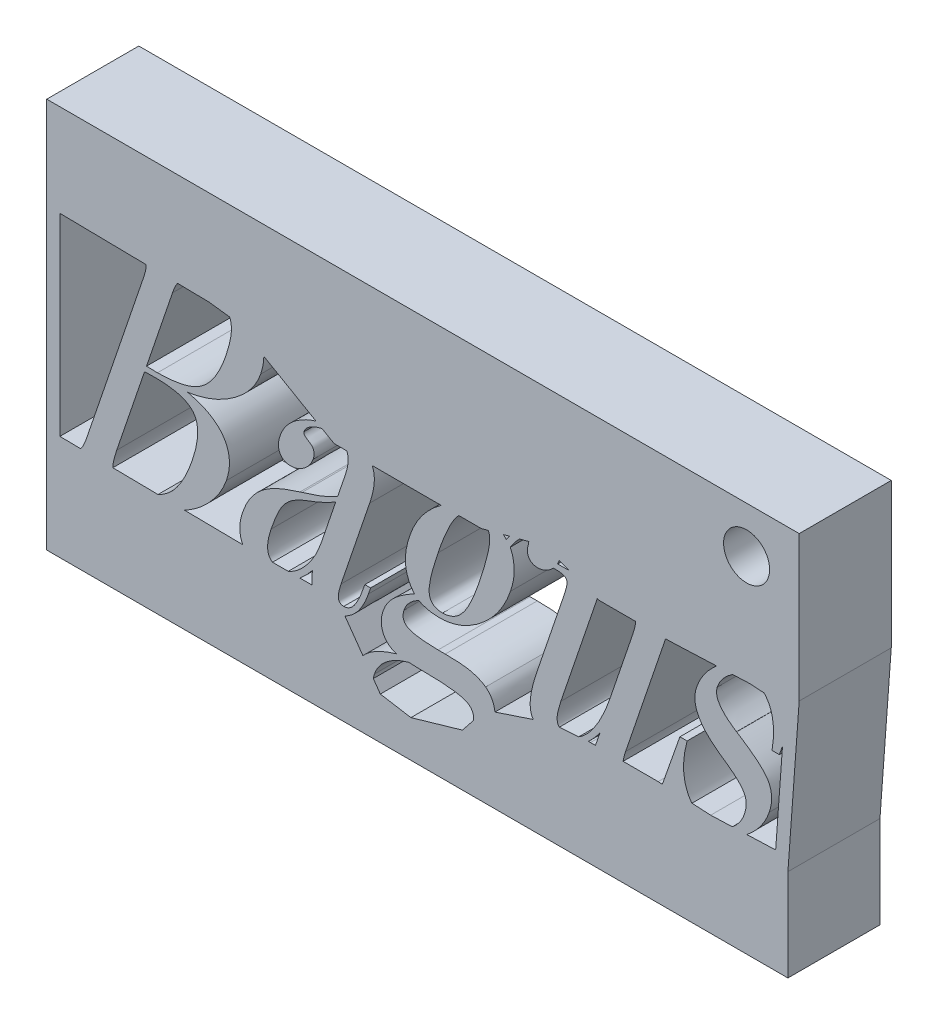
from build123d import *

# Parameters (mm, degrees)
BOSS_EXTRUDE1_DEPTH = 7
BOSS_EXTRUDE3_DEPTH = 7
BOSS_EXTRUDE4_DEPTH = 7
SKETCH4_R           = 1.75
CUT_EXTRUDE1_DEPTH  = 62.943507145


with BuildPart() as part:
    # Sketch1 → Boss-Extrude1 (new body)
    # profile 1 of 5: a face of its own
    with BuildSketch(Plane.XY):
        with BuildLine():
            Line((0.217105263, 0), (0.366365132, 0.434210526))
            Line((0.366365132, 0.434210526), (1.102487664, 0.434210526))
            add(Edge.make_bspline(
                [(1.102487664, 0.434210526), (1.234941951, 0.436867578), (1.483057386, 0.44184481), (1.826532671, 0.492741642), (2.111874884, 0.584655965), (2.352565812, 0.712506725), (2.546627765, 0.909076169), (2.723285687, 1.161183153), (2.884267508, 1.48339522), (2.972030419, 1.725609965), (3.019120066, 1.855571546)],
                knots=[0, 0, 0, 0, 1.208670935, 2.26410124, 3.155129681, 3.936062639, 4.724394753, 5.649444076, 6.738796995, 8, 8, 8, 8], degree=3))
            Line((3.019120066, 1.855571546), (7.384971217, 14.69870477))
            add(Edge.make_bspline(
                [(7.384971217, 14.69870477), (7.423759516, 14.821184991), (7.493759767, 15.042221915), (7.553531903, 15.348860217), (7.557136275, 15.593105356), (7.502714672, 15.789953243), (7.358367624, 15.925122809), (7.150285742, 16.008127942), (6.872979863, 16.060205863), (6.663842277, 16.063789003), (6.547080592, 16.065789474)],
                knots=[0, 0, 0, 0, 1.447238597, 2.611794517, 3.503668476, 4.188541488, 4.837144007, 5.646895606, 6.686259889, 8, 8, 8, 8], degree=3))
            Line((6.547080592, 16.065789474), (6.414782072, 16.065789474))
            Line((6.414782072, 16.065789474), (5.678659539, 16.065789474))
            Line((5.678659539, 16.065789474), (5.824527138, 16.5))
            Line((5.824527138, 16.5), (12.398745888, 16.5))
            add(Edge.make_bspline(
                [(12.398745888, 16.5), (12.600139396, 16.498290198), (12.987714338, 16.494999744), (13.544870697, 16.44516658), (14.055297532, 16.373066953), (14.519531068, 16.270275886), (14.934655872, 16.130320904), (15.304959961, 15.96563611), (15.627932198, 15.768491413), (15.901447534, 15.539236803), (16.131392692, 15.28417944), (16.300380282, 14.9937932), (16.426488912, 14.680085544), (16.495836229, 14.337904198), (16.515286773, 13.968978488), (16.482026895, 13.573862309), (16.400068058, 13.150711955), (16.309677894, 12.866059934), (16.262541118, 12.717619243)],
                knots=[0, 0, 0, 0, 1.438019672, 2.767419842, 3.991889429, 5.118498219, 6.158013592, 7.115880268, 8.007983498, 8.850792557, 9.657697218, 10.447235635, 11.23764111, 12.062930467, 12.928497478, 13.868213022, 14.888313067, 16, 16, 16, 16], degree=3))
            add(Edge.make_bspline(
                [(16.262541118, 12.717619243), (16.218634237, 12.596715491), (16.130671164, 12.354496843), (15.952703511, 12.006698007), (15.747777661, 11.666842799), (15.502742741, 11.341217693), (15.233062048, 11.020777029), (14.924965338, 10.715209538), (14.584983832, 10.420995194), (14.218194262, 10.137023214), (13.826093864, 9.874889842), (13.419957451, 9.633996791), (13.000413262, 9.418111286), (12.56681607, 9.232836565), (12.119238739, 9.07236544), (11.659456287, 8.937421647), (11.186208345, 8.826888953), (10.864690986, 8.777136571), (10.70261102, 8.752055921)],
                knots=[0, 0, 0, 0, 0.861657859, 1.726245857, 2.614315257, 3.519564351, 4.455378282, 5.420343214, 6.425254088, 7.468555063, 8.528336489, 9.585429798, 10.633156394, 11.689379355, 12.744540606, 13.819294024, 14.900685323, 16, 16, 16, 16], degree=3))
            add(Edge.make_bspline(
                [(10.70261102, 8.752055921), (10.860335548, 8.714595528), (11.167340721, 8.641680207), (11.604839812, 8.500627919), (12.0028058, 8.331133222), (12.369643187, 8.152694559), (12.691447345, 7.939208905), (12.980819076, 7.711070505), (13.234170914, 7.460555567), (13.444160503, 7.183428747), (13.618366233, 6.891494078), (13.753575336, 6.583351606), (13.841127668, 6.257332175), (13.888481883, 5.916616259), (13.894308462, 5.56028515), (13.859718941, 5.188326668), (13.781018644, 4.800891349), (13.699296883, 4.542703331), (13.657277961, 4.409950658)],
                knots=[0, 0, 0, 0, 1.27154665, 2.475020249, 3.600264177, 4.663480099, 5.669811574, 6.622971171, 7.551328935, 8.456206246, 9.343165159, 10.213284382, 11.0870137, 11.982757003, 12.905503248, 13.876494216, 14.908155881, 16, 16, 16, 16], degree=3))
            add(Edge.make_bspline(
                [(13.657277961, 4.409950658), (13.589051228, 4.230566629), (13.45023318, 3.86558153), (13.160076787, 3.344087635), (12.807345816, 2.834412801), (12.392618835, 2.346154179), (11.933376365, 1.88355635), (11.42966199, 1.468123355), (10.894561581, 1.094646739), (10.511391764, 0.887480051), (10.319284539, 0.783614309)],
                knots=[0, 0, 0, 0, 0.912300883, 1.85622004, 2.83089555, 3.858144996, 4.90068446, 5.928610154, 6.961481476, 8, 8, 8, 8], degree=3))
            add(Edge.make_bspline(
                [(10.319284539, 0.783614309), (10.178977761, 0.716722531), (9.895225059, 0.581442375), (9.444390053, 0.421235915), (8.973029833, 0.285661676), (8.471491116, 0.174701809), (7.923036024, 0.092530897), (7.310995951, 0.043792449), (6.629039031, 0.002632619), (6.15026232, 0.000905714), (5.899157072, 0)],
                knots=[0, 0, 0, 0, 0.822773354, 1.663954969, 2.530197419, 3.419485951, 4.382510394, 5.464765732, 6.670339192, 8, 8, 8, 8], degree=3))
            Line((5.899157072, 0), (0.217105263, 0))
        make_face()
        with BuildLine():
            add(Edge.make_bspline(
                [(7.585115132, 8.901315789), (7.637130553, 8.899085972), (7.744547501, 8.89448118), (7.923131525, 8.886150784), (8.14822922, 8.883637163), (8.317847702, 8.884091145), (8.416221217, 8.884354441)],
                knots=[0, 0, 0, 0, 0.751447154, 1.55181209, 2.580126133, 4, 4, 4, 4], degree=3))
            add(Edge.make_bspline(
                [(8.416221217, 8.884354441), (8.596065824, 8.887176725), (8.945976945, 8.892667847), (9.453626122, 8.928719056), (9.926998477, 8.993550493), (10.36481324, 9.080285905), (10.769008852, 9.192292165), (11.139289434, 9.329312465), (11.473689863, 9.497145905), (11.779147568, 9.689078119), (12.058315578, 9.919029794), (12.322269579, 10.184304091), (12.575656779, 10.488743458), (12.81191804, 10.836334651), (13.035142641, 11.225254045), (13.248814923, 11.65304914), (13.449370302, 12.122010726), (13.56640278, 12.452320203), (13.626747533, 12.622635691)],
                knots=[0, 0, 0, 0, 1.228843792, 2.390875742, 3.474794627, 4.491507911, 5.438172019, 6.337926543, 7.184458294, 7.990349871, 8.797610598, 9.649869939, 10.544134351, 11.499929116, 12.517669339, 13.606067304, 14.765630891, 16, 16, 16, 16], degree=3))
            add(Edge.make_bspline(
                [(13.626747533, 12.622635691), (13.678160512, 12.779312011), (13.776275609, 13.078308736), (13.890368512, 13.51259739), (13.977783411, 13.906997767), (14.031819423, 14.263965069), (14.04548827, 14.584614775), (14.030487336, 14.866851992), (13.986500548, 15.113472553), (13.900112731, 15.324518723), (13.771955654, 15.503241774), (13.606264957, 15.660683599), (13.389911318, 15.782644111), (13.136547067, 15.889161362), (12.839616265, 15.968258331), (12.499941566, 16.023945053), (12.118063133, 16.062616243), (11.848173559, 16.064698271), (11.706722862, 16.065789474)],
                knots=[0, 0, 0, 0, 1.527187893, 2.914442836, 4.157405935, 5.268415371, 6.253927988, 7.12490396, 7.882927641, 8.563782973, 9.217675974, 9.906860121, 10.663144881, 11.503539457, 12.448877272, 13.501050069, 14.690285788, 16, 16, 16, 16], degree=3))
            add(Edge.make_bspline(
                [(11.706722862, 16.065789474), (11.616228163, 16.065692214), (11.444169017, 16.065507293), (11.197775517, 16.049156663), (10.974513926, 16.034944012), (10.774762155, 16.00889151), (10.599603421, 15.970263381), (10.447863225, 15.928577786), (10.319780507, 15.876537518), (10.172840932, 15.799401601), (10.017569146, 15.64451563), (9.850985249, 15.403640371), (9.693434169, 15.090404759), (9.608570144, 14.851354965), (9.562808388, 14.722450658)],
                knots=[0, 0, 0, 0, 1.154282481, 2.194657372, 3.149594583, 4.008600807, 4.761318719, 5.437100536, 6.01311362, 6.523199377, 7.544186702, 8.765157702, 10.255655865, 12, 12, 12, 12], degree=3))
            Line((9.562808388, 14.722450658), (7.585115132, 8.901315789))
        make_face(mode=Mode.SUBTRACT)
        with BuildLine():
            Line((7.435855263, 8.467105263), (5.322471217, 2.242290296))
            add(Edge.make_bspline(
                [(5.322471217, 2.242290296), (5.290019764, 2.146426186), (5.228878203, 1.965809274), (5.154234407, 1.706337491), (5.095694406, 1.47567724), (5.054253372, 1.27200145), (5.029353732, 1.096342986), (5.021646796, 0.94874358), (5.027770921, 0.828718363), (5.068722488, 0.703890282), (5.191336841, 0.581888394), (5.408075625, 0.493760256), (5.702482482, 0.444025514), (5.923810294, 0.437745915), (6.048416941, 0.434210526)],
                knots=[0, 0, 0, 0, 1.390169981, 2.619209722, 3.708019823, 4.658507913, 5.473553434, 6.142230563, 6.68790843, 7.115300736, 7.917815528, 8.960435782, 10.288737856, 12, 12, 12, 12], degree=3))
            add(Edge.make_bspline(
                [(6.048416941, 0.434210526), (6.212494391, 0.436338323), (6.5322339, 0.440484784), (6.996737768, 0.486343037), (7.434930662, 0.555702762), (7.842639173, 0.658029038), (8.225849973, 0.782316815), (8.577512712, 0.94213473), (8.902456257, 1.129688663), (9.202111128, 1.346039732), (9.481539048, 1.598795293), (9.74438001, 1.89110991), (9.996500462, 2.22295056), (10.236852549, 2.594288251), (10.467786148, 3.00510424), (10.683233915, 3.456882835), (10.888365454, 3.948220404), (11.009653985, 4.292826617), (11.072368421, 4.471011513)],
                knots=[0, 0, 0, 0, 1.120106024, 2.182762763, 3.184383901, 4.147027273, 5.050526258, 5.931808077, 6.779463741, 7.608915652, 8.45092492, 9.347467439, 10.289574728, 11.294079005, 12.365870858, 13.505608066, 14.71022938, 16, 16, 16, 16], degree=3))
            add(Edge.make_bspline(
                [(11.072368421, 4.471011513), (11.129940804, 4.646755025), (11.239775043, 4.982031313), (11.362988682, 5.471533181), (11.441944302, 5.92056287), (11.483014667, 6.330205341), (11.477256115, 6.700230266), (11.432230989, 7.032054563), (11.341753124, 7.324798202), (11.202971433, 7.580395018), (11.014273213, 7.799584292), (10.773909419, 7.983895222), (10.483970748, 8.140278809), (10.141678908, 8.268519659), (9.747138291, 8.363362101), (9.302541203, 8.433771749), (8.806096603, 8.478223092), (8.457029149, 8.482054744), (8.273745888, 8.484066612)],
                knots=[0, 0, 0, 0, 1.393004691, 2.657517412, 3.798988081, 4.82557211, 5.75431571, 6.580804943, 7.340587003, 8.049726249, 8.75661035, 9.503045377, 10.318929091, 11.230279023, 12.24891427, 13.370760442, 14.619477142, 16, 16, 16, 16], degree=3))
            add(Edge.make_bspline(
                [(8.273745888, 8.484066612), (8.175362578, 8.484605399), (8.004596504, 8.485540582), (7.77736708, 8.480303109), (7.596235802, 8.479410658), (7.487844676, 8.471094215), (7.435855263, 8.467105263)],
                knots=[0, 0, 0, 0, 1.40824818, 2.444327315, 3.253827201, 4, 4, 4, 4], degree=3))
        make_face(mode=Mode.SUBTRACT)
    # profile 2 of 5: a face of its own
    with BuildSketch(Plane.XY):
        with BuildLine():
            add(Edge.make_bspline(
                [(20.214535362, 1.774157072), (20.088449891, 1.622329559), (19.84170956, 1.325213876), (19.430491009, 0.930981483), (19.003095336, 0.585537883), (18.556552575, 0.296932551), (18.099976199, 0.069811823), (17.642172343, -0.09699456), (17.182624105, -0.195284108), (16.875850721, -0.209876759), (16.723889803, -0.217105263)],
                knots=[0, 0, 0, 0, 1.139849853, 2.230605373, 3.285956203, 4.312004243, 5.29695576, 6.227180238, 7.121829557, 8, 8, 8, 8], degree=3))
            add(Edge.make_bspline(
                [(16.723889803, -0.217105263), (16.624181528, -0.215065128), (16.431617702, -0.211125071), (16.154187999, -0.164880399), (15.89845364, -0.095329545), (15.664978033, 0.004670151), (15.45146593, 0.129498588), (15.264111938, 0.289094796), (15.095057517, 0.473196489), (14.954658183, 0.687259406), (14.839155603, 0.920740456), (14.754277992, 1.170535024), (14.698281714, 1.434669189), (14.681152469, 1.712867978), (14.687355019, 2.004727917), (14.724974566, 2.310613293), (14.798131861, 2.629820427), (14.864619564, 2.844266216), (14.898848684, 2.954666941)],
                knots=[0, 0, 0, 0, 1.081173563, 2.088040521, 3.04394778, 3.951266017, 4.83741842, 5.717429943, 6.612378118, 7.541677243, 8.485771469, 9.432812885, 10.39805088, 11.407159474, 12.450686423, 13.563511442, 14.74564987, 16, 16, 16, 16], degree=3))
            add(Edge.make_bspline(
                [(14.898848684, 2.954666941), (14.97907541, 3.167545044), (15.135124588, 3.581614699), (15.46032802, 4.14854708), (15.845326601, 4.648115379), (16.221300601, 5.011942683), (16.562707126, 5.269139119), (16.849576297, 5.458851893), (17.171895692, 5.638249091), (17.52459097, 5.813243285), (17.907613145, 5.988406285), (18.327278685, 6.148489439), (18.776772809, 6.309058653), (19.090166078, 6.405800749), (19.251130757, 6.455489309)],
                knots=[0, 0, 0, 0, 1.399043964, 2.721283421, 4.006785783, 5.272371403, 5.928291506, 6.637039866, 7.388422193, 8.198039113, 9.06127237, 9.98061478, 10.962805763, 12, 12, 12, 12], degree=3))
            Line((19.251130757, 6.455489309), (19.417351974, 6.509765625))
            add(Edge.make_bspline(
                [(19.417351974, 6.509765625), (19.562314474, 6.553148057), (19.842942416, 6.637130623), (20.248352658, 6.771316078), (20.627467283, 6.901018466), (20.979075068, 7.037633249), (21.302448296, 7.177422497), (21.602300469, 7.310495555), (21.872605986, 7.450578829), (22.040025622, 7.550406726), (22.120990954, 7.598684211)],
                knots=[0, 0, 0, 0, 1.242513737, 2.405339811, 3.506584697, 4.532600578, 5.501921333, 6.399516388, 7.225994688, 8, 8, 8, 8], degree=3))
            Line((22.120990954, 7.598684211), (22.704461349, 9.311780428))
            add(Edge.make_bspline(
                [(22.704461349, 9.311780428), (22.73358424, 9.403104511), (22.789287393, 9.577779452), (22.855630359, 9.832104012), (22.895448143, 10.069571346), (22.921540691, 10.286860012), (22.923133649, 10.487529199), (22.898072288, 10.666987235), (22.859725088, 10.830649184), (22.793536922, 10.974522759), (22.708084675, 11.103294065), (22.5970174, 11.213397208), (22.463001692, 11.304653762), (22.30767975, 11.380139233), (22.129442684, 11.43736245), (21.927763903, 11.475850716), (21.704576377, 11.505074699), (21.547805935, 11.506064326), (21.466282895, 11.506578947)],
                knots=[0, 0, 0, 0, 1.436058625, 2.74673937, 3.933185623, 5.040690946, 6.023245238, 6.928893744, 7.750643393, 8.531566063, 9.288035071, 10.054678715, 10.858241513, 11.706794358, 12.633585601, 13.653544259, 14.77980695, 16, 16, 16, 16], degree=3))
            add(Edge.make_bspline(
                [(21.466282895, 11.506578947), (21.355279259, 11.50338452), (21.136595715, 11.497091314), (20.817676143, 11.445633918), (20.514987668, 11.359822351), (20.235802473, 11.243982946), (19.988994375, 11.104572707), (19.78787098, 10.945713747), (19.637459304, 10.765352597), (19.578416223, 10.629644708), (19.549650493, 10.563527961)],
                knots=[0, 0, 0, 0, 1.180444473, 2.325543472, 3.426047797, 4.520750933, 5.53389207, 6.431939949, 7.236042708, 8, 8, 8, 8], degree=3))
            add(Edge.make_bspline(
                [(19.549650493, 10.563527961), (19.54716895, 10.528636335), (19.541339439, 10.446670749), (19.6381574, 10.328415812), (19.78374555, 10.203268025), (19.952041062, 10.101757505), (20.095929304, 10.00197849), (20.188953356, 9.909936249), (20.259954779, 9.80561011), (20.303442015, 9.686762005), (20.327889107, 9.556021979), (20.326308896, 9.412618677), (20.302298821, 9.258335241), (20.269181674, 9.155353566), (20.251850329, 9.101459704)],
                knots=[0, 0, 0, 0, 0.679842975, 1.597051626, 2.864780599, 4.579674238, 5.503847368, 6.368665887, 7.185281905, 8.009712609, 8.884849764, 9.836101602, 10.867557336, 12, 12, 12, 12], degree=3))
            add(Edge.make_bspline(
                [(20.251850329, 9.101459704), (20.217453335, 9.014058555), (20.149082836, 8.84033232), (19.992490823, 8.602488446), (19.80402179, 8.379882044), (19.573724449, 8.190201172), (19.333193281, 8.021921267), (19.07735668, 7.906647529), (18.820274573, 7.829511961), (18.645573159, 7.820332626), (18.55910773, 7.815789474)],
                knots=[0, 0, 0, 0, 0.99912011, 1.985939284, 3.020523476, 4.09826957, 5.158468049, 6.140486592, 7.079666153, 8, 8, 8, 8], degree=3))
            add(Edge.make_bspline(
                [(18.55910773, 7.815789474), (18.465840196, 7.820416781), (18.289872154, 7.829147131), (18.045517016, 7.909455057), (17.854820579, 8.057216829), (17.710026198, 8.251882359), (17.633112334, 8.495352192), (17.605169308, 8.770403356), (17.644634574, 9.077079511), (17.705641172, 9.285453117), (17.738178454, 9.396587171)],
                knots=[0, 0, 0, 0, 1.033141607, 1.949230329, 2.799440286, 3.669756868, 4.59769849, 5.593405307, 6.716465912, 8, 8, 8, 8], degree=3))
            add(Edge.make_bspline(
                [(17.738178454, 9.396587171), (17.772375508, 9.490154514), (17.840628086, 9.676901955), (17.978094306, 9.940846052), (18.139355488, 10.191811793), (18.326313915, 10.428571805), (18.537731411, 10.654160189), (18.775195994, 10.864090219), (19.039871084, 11.058305799), (19.325653062, 11.239262794), (19.629321677, 11.40619256), (19.950125075, 11.547796622), (20.281641579, 11.670779902), (20.625788908, 11.767849835), (20.979874424, 11.847832532), (21.347481533, 11.899992387), (21.726764804, 11.93608659), (21.984081312, 11.939209976), (22.114206414, 11.940789474)],
                knots=[0, 0, 0, 0, 0.885660827, 1.767656203, 2.641232209, 3.536952197, 4.448080539, 5.388946387, 6.352878962, 7.366120584, 8.397190129, 9.433108567, 10.483583949, 11.540879736, 12.612583806, 13.711110863, 14.842507474, 16, 16, 16, 16], degree=3))
            add(Edge.make_bspline(
                [(22.114206414, 11.940789474), (22.269178636, 11.938031578), (22.566034846, 11.932748707), (22.990415312, 11.89734208), (23.372363226, 11.832262801), (23.712761206, 11.748193578), (24.008121609, 11.630900193), (24.263621701, 11.494024877), (24.473638434, 11.324812511), (24.645501295, 11.131585136), (24.774488069, 10.904341176), (24.857173484, 10.641974292), (24.903400823, 10.347161901), (24.912601398, 10.017843584), (24.878774154, 9.654563897), (24.809947738, 9.255293566), (24.70005681, 8.821683976), (24.603649558, 8.524234473), (24.553248355, 8.368729441)],
                knots=[0, 0, 0, 0, 1.329265806, 2.546267989, 3.648023516, 4.650122256, 5.547014111, 6.367501182, 7.126345866, 7.848023914, 8.573407067, 9.349350652, 10.194404402, 11.125918476, 12.167326422, 13.318514593, 14.598133571, 16, 16, 16, 16], degree=3))
            Line((24.553248355, 8.368729441), (22.375411184, 1.953947368))
            add(Edge.make_bspline(
                [(22.375411184, 1.953947368), (22.33865993, 1.842495608), (22.270973998, 1.637231422), (22.201944058, 1.349272808), (22.167279036, 1.110184294), (22.170145565, 0.917959714), (22.209831475, 0.763793844), (22.303391084, 0.657467086), (22.431643493, 0.591612117), (22.529434239, 0.586328736), (22.582339638, 0.583470395)],
                knots=[0, 0, 0, 0, 1.712323239, 3.15363915, 4.318562976, 5.226987591, 5.952684351, 6.584668582, 7.234296926, 8, 8, 8, 8], degree=3))
            add(Edge.make_bspline(
                [(22.582339638, 0.583470395), (22.656804909, 0.589366812), (22.809505105, 0.601458141), (23.027318541, 0.70390513), (23.228639407, 0.868398377), (23.422326161, 1.097091612), (23.607528514, 1.405056126), (23.800613301, 1.79554367), (23.997741163, 2.277263663), (24.122963711, 2.631794756), (24.190275493, 2.822368421)],
                knots=[0, 0, 0, 0, 0.611759868, 1.254488841, 1.944624153, 2.744481208, 3.71193818, 4.900177251, 6.333729841, 8, 8, 8, 8], degree=3))
            Line((24.190275493, 2.822368421), (24.62448602, 2.822368421))
            Line((24.62448602, 2.822368421), (24.461657072, 2.344058388))
            add(Edge.make_bspline(
                [(24.461657072, 2.344058388), (24.38825811, 2.1441702), (24.247837573, 1.761761429), (23.972656645, 1.243039912), (23.669766814, 0.793602522), (23.32030192, 0.428549589), (22.941451933, 0.134507618), (22.521355568, -0.066917391), (22.070843633, -0.195181597), (21.757760626, -0.209715742), (21.598581414, -0.217105263)],
                knots=[0, 0, 0, 0, 1.237567003, 2.367606009, 3.407820714, 4.380363054, 5.296153808, 6.181791411, 7.075577397, 8, 8, 8, 8], degree=3))
            add(Edge.make_bspline(
                [(21.598581414, -0.217105263), (21.464433834, -0.212613408), (21.213662579, -0.204216477), (20.868001743, -0.10759007), (20.581004541, 0.049134281), (20.362206435, 0.27900763), (20.217198418, 0.573190165), (20.146514994, 0.925676049), (20.142546059, 1.334556236), (20.18943062, 1.620855605), (20.214535362, 1.774157072)],
                knots=[0, 0, 0, 0, 1.104978236, 2.065611451, 2.935366515, 3.774096222, 4.642647611, 5.607807869, 6.719080087, 8, 8, 8, 8], degree=3))
        make_face()
        with BuildLine():
            add(Edge.make_bspline(
                [(21.975123355, 7.164473684), (21.864219429, 7.093693626), (21.631738024, 6.945321533), (21.244093657, 6.749153964), (20.815589216, 6.547756626), (20.359983718, 6.365882612), (19.928571083, 6.203673244), (19.569952034, 6.061577659), (19.303170024, 5.951643074), (19.159342324, 5.882632984), (19.101870888, 5.855057566)],
                knots=[0, 0, 0, 0, 0.997640605, 2.091295583, 3.292708918, 4.589551463, 5.811617501, 6.78981225, 7.516426761, 8, 8, 8, 8], degree=3))
            add(Edge.make_bspline(
                [(19.101870888, 5.855057566), (18.988468622, 5.793014046), (18.767049302, 5.671873309), (18.464229558, 5.451952907), (18.199702985, 5.202921441), (18.00223936, 4.97231917), (17.857192148, 4.764630439), (17.749951708, 4.579556613), (17.637364969, 4.369904763), (17.526777139, 4.13101457), (17.410660713, 3.865528977), (17.293231451, 3.572452705), (17.173766896, 3.251069511), (17.09655927, 3.027205813), (17.056332237, 2.910567434)],
                knots=[0, 0, 0, 0, 1.25813146, 2.456517158, 3.633095027, 4.789447859, 5.406590551, 6.097894245, 6.871422753, 7.723733418, 8.660842289, 9.693636981, 10.798329316, 12, 12, 12, 12], degree=3))
            add(Edge.make_bspline(
                [(17.056332237, 2.910567434), (17.000166291, 2.739804666), (16.895790573, 2.422468488), (16.810683696, 1.966400551), (16.782556683, 1.574055952), (16.825063762, 1.243452178), (16.938479514, 0.973066983), (17.13520898, 0.781833197), (17.397356381, 0.667774675), (17.592181274, 0.657090096), (17.697471217, 0.651315789)],
                knots=[0, 0, 0, 0, 1.521950483, 2.828309429, 3.922350226, 4.842623888, 5.631801677, 6.356931434, 7.112030331, 8, 8, 8, 8], degree=3))
            add(Edge.make_bspline(
                [(17.697471217, 0.651315789), (17.771195891, 0.653699632), (17.919963315, 0.658509937), (18.143277126, 0.705832229), (18.367743438, 0.780326829), (18.591827588, 0.887439493), (18.816248126, 1.020683657), (19.043012067, 1.181806488), (19.267763899, 1.375862677), (19.575149904, 1.67297393), (19.933496973, 2.102358218), (20.320751603, 2.678915656), (20.650167516, 3.327120665), (20.821894337, 3.79176228), (20.909950658, 4.030016447)],
                knots=[0, 0, 0, 0, 0.538733715, 1.087099116, 1.662622137, 2.265838828, 2.9000266, 3.570308334, 4.298011697, 5.070245481, 6.696156416, 8.377950119, 10.142722366, 12, 12, 12, 12], degree=3))
            Line((20.909950658, 4.030016447), (21.975123355, 7.164473684))
        make_face(mode=Mode.SUBTRACT)
    # profile 3 of 5: a face of its own
    with BuildSketch(Plane.XY):
        with BuildLine():
            add(Edge.make_bspline(
                [(27.945518092, 4.094469572), (27.855896184, 4.214172556), (27.679471705, 4.449812894), (27.481039739, 4.841591194), (27.348486459, 5.255190684), (27.270953944, 5.692385959), (27.265851025, 6.160452331), (27.314045189, 6.663350244), (27.428319509, 7.203998414), (27.545236149, 7.570252058), (27.606291118, 7.761513158)],
                knots=[0, 0, 0, 0, 0.927873524, 1.826557902, 2.713102757, 3.618709349, 4.574494078, 5.612007175, 6.75296767, 8, 8, 8, 8], degree=3))
            add(Edge.make_bspline(
                [(27.606291118, 7.761513158), (27.65923965, 7.909508939), (27.764361541, 8.203333828), (27.964760374, 8.624504213), (28.187689803, 9.028717996), (28.439079926, 9.414311665), (28.722932551, 9.777372777), (29.031246576, 10.124054625), (29.368457314, 10.451359879), (29.732489371, 10.753744194), (30.112521976, 11.027808053), (30.495466271, 11.276202777), (30.887863587, 11.480449336), (31.284950243, 11.644949254), (31.682616582, 11.781440588), (32.086763576, 11.870566823), (32.493737291, 11.932893436), (32.767959205, 11.938158149), (32.905016447, 11.940789474)],
                knots=[0, 0, 0, 0, 1.051283255, 2.087175627, 3.116886159, 4.139005898, 5.163727345, 6.19809848, 7.241618643, 8.305436471, 9.361935697, 10.375843247, 11.357381835, 12.317241769, 13.25048414, 14.166479169, 15.083598731, 16, 16, 16, 16], degree=3))
            add(Edge.make_bspline(
                [(32.905016447, 11.940789474), (33.011461676, 11.939655464), (33.218282155, 11.937452111), (33.517340119, 11.896942132), (33.799062663, 11.842349864), (34.06028721, 11.755034841), (34.308447082, 11.650623217), (34.539594716, 11.517452686), (34.755973192, 11.357939319), (34.883077245, 11.231235673), (34.947162829, 11.167351974)],
                knots=[0, 0, 0, 0, 1.135252948, 2.205768752, 3.216639522, 4.193869854, 5.140117175, 6.086364497, 7.035149195, 8, 8, 8, 8], degree=3))
            add(Edge.make_bspline(
                [(34.947162829, 11.167351974), (35.057481001, 11.326620808), (35.270172862, 11.633688848), (35.623635124, 12.045633826), (35.982124469, 12.406123089), (36.355479184, 12.705010905), (36.731881696, 12.944639024), (37.111362409, 13.11363669), (37.486441107, 13.222637022), (37.738325337, 13.236609344), (37.861122533, 13.243421053)],
                knots=[0, 0, 0, 0, 1.250815525, 2.411554495, 3.501428286, 4.530435651, 5.495212588, 6.374848295, 7.207715094, 8, 8, 8, 8], degree=3))
            add(Edge.make_bspline(
                [(37.861122533, 13.243421053), (37.9691216, 13.238798264), (38.171417527, 13.230139196), (38.452821733, 13.150950543), (38.688866069, 13.017915179), (38.866527392, 12.825826657), (38.992331744, 12.599185244), (39.050692316, 12.339654385), (39.037613013, 12.055468762), (38.982620617, 11.867531479), (38.953433388, 11.767783717)],
                knots=[0, 0, 0, 0, 1.163288113, 2.17898593, 3.124932212, 4.048499728, 4.965839695, 5.892304433, 6.881340031, 8, 8, 8, 8], degree=3))
            add(Edge.make_bspline(
                [(38.953433388, 11.767783717), (38.919956888, 11.681681811), (38.853102211, 11.509730888), (38.703277152, 11.273555735), (38.517039749, 11.057846987), (38.300524555, 10.86481075), (38.064719126, 10.704124102), (37.820762192, 10.585289773), (37.573350222, 10.514252092), (37.406979354, 10.504078888), (37.325143914, 10.499074836)],
                knots=[0, 0, 0, 0, 1.012270629, 2.021568133, 3.051646915, 4.133107625, 5.197040845, 6.174298808, 7.101963814, 8, 8, 8, 8], degree=3))
            add(Edge.make_bspline(
                [(37.325143914, 10.499074836), (37.266007969, 10.501130421), (37.151578658, 10.505108023), (36.99189728, 10.550847272), (36.849640666, 10.619751563), (36.730914484, 10.71848245), (36.638027901, 10.841831425), (36.577365361, 10.98415162), (36.541548571, 11.141808409), (36.541536138, 11.251953269), (36.541529605, 11.309827303)],
                knots=[0, 0, 0, 0, 1.103759446, 2.135797965, 3.082263882, 4.044219732, 4.99658269, 5.944230951, 6.919825687, 8, 8, 8, 8], degree=3))
            add(Edge.make_bspline(
                [(36.541529605, 11.309827303), (36.547135665, 11.359809982), (36.560426958, 11.478312887), (36.593591193, 11.592947542), (36.61276727, 11.659231086)],
                knots=[0, 0, 0, 0, 0.843568844, 2, 2, 2, 2], degree=3))
            add(Edge.make_bspline(
                [(36.61276727, 11.659231086), (36.626912254, 11.71756017), (36.650973274, 11.816779599), (36.65022706, 11.952213323), (36.587683518, 12.055396428), (36.517318671, 12.060328348), (36.48046875, 12.062911184)],
                knots=[0, 0, 0, 0, 1.422526435, 2.419757846, 3.172430556, 4, 4, 4, 4], degree=3))
            add(Edge.make_bspline(
                [(36.48046875, 12.062911184), (36.446986131, 12.058090627), (36.366941414, 12.046566433), (36.247102159, 11.967149859), (36.099249683, 11.860424615), (35.87448778, 11.640020404), (35.567690275, 11.301680399), (35.357797415, 10.984160206), (35.245682566, 10.814555921)],
                knots=[0, 0, 0, 0, 0.336754334, 0.805056667, 1.414567193, 2.178822464, 3.958907505, 6, 6, 6, 6], degree=3))
            add(Edge.make_bspline(
                [(35.245682566, 10.814555921), (35.291235199, 10.706931357), (35.382061854, 10.49234049), (35.471592184, 10.155670201), (35.526415792, 9.813454934), (35.546199029, 9.46463407), (35.533650116, 9.101839701), (35.475476258, 8.723497769), (35.388855015, 8.322145108), (35.301341275, 8.053686387), (35.255859375, 7.914165296)],
                knots=[0, 0, 0, 0, 0.941746586, 1.877733201, 2.801461946, 3.733440034, 4.691868397, 5.72382263, 6.81704439, 8, 8, 8, 8], degree=3))
            add(Edge.make_bspline(
                [(35.255859375, 7.914165296), (35.199657524, 7.755939688), (35.088388029, 7.442681612), (34.876814989, 6.99375712), (34.645175747, 6.56268573), (34.381842155, 6.154308941), (34.093273225, 5.765334987), (33.773177489, 5.39926175), (33.426364336, 5.052502339), (33.056121745, 4.728992876), (32.670243788, 4.437217855), (32.277594864, 4.17981602), (31.881878749, 3.962750432), (31.481418295, 3.784420614), (31.077739654, 3.644223813), (30.669886702, 3.545950831), (30.258561814, 3.486076133), (29.983337908, 3.477825579), (29.845189145, 3.473684211)],
                knots=[0, 0, 0, 0, 1.083212028, 2.144563826, 3.19949648, 4.240167649, 5.278070799, 6.323109673, 7.375969815, 8.441604557, 9.494110447, 10.496210748, 11.469590819, 12.404102501, 13.322774585, 14.223852296, 15.10846186, 16, 16, 16, 16], degree=3))
            add(Edge.make_bspline(
                [(29.845189145, 3.473684211), (29.703588364, 3.477166604), (29.426750429, 3.48397489), (29.021063336, 3.550142665), (28.631760182, 3.662999688), (28.385426388, 3.771616263), (28.260999178, 3.826480263)],
                knots=[0, 0, 0, 0, 1.037381116, 2.02814169, 3.003982265, 4, 4, 4, 4], degree=3))
            add(Edge.make_bspline(
                [(28.260999178, 3.826480263), (28.125691378, 3.743559362), (27.872048509, 3.588118985), (27.554788364, 3.303393577), (27.308380637, 2.990225875), (27.213049387, 2.751822398), (27.165296053, 2.632401316)],
                knots=[0, 0, 0, 0, 1.146713159, 2.149584985, 3.073090006, 4, 4, 4, 4], degree=3))
            add(Edge.make_bspline(
                [(27.165296053, 2.632401316), (27.147997361, 2.576225331), (27.115196865, 2.469708595), (27.090821175, 2.311062373), (27.089116143, 2.165404415), (27.114068222, 2.030995816), (27.160030296, 1.908663874), (27.235094742, 1.799061141), (27.334540442, 1.705368944), (27.458447171, 1.620204798), (27.614715961, 1.549686071), (27.806661193, 1.490874591), (28.036325289, 1.435368458), (28.305580517, 1.395049819), (28.613015011, 1.355957488), (28.958441585, 1.331556258), (29.342881058, 1.309611384), (29.612215766, 1.305034255), (29.753597862, 1.302631579)],
                knots=[0, 0, 0, 0, 0.807745, 1.531586176, 2.200519436, 2.80161599, 3.402511206, 3.985001028, 4.612107116, 5.272300535, 6.04482256, 6.959888486, 8.031487839, 9.292339414, 10.702851002, 12.294495936, 14.054866613, 16, 16, 16, 16], degree=3))
            Line((29.753597862, 1.302631579), (30.29636102, 1.302631579))
            add(Edge.make_bspline(
                [(30.29636102, 1.302631579), (30.49653137, 1.30057791), (30.871071025, 1.296735279), (31.394193486, 1.271712756), (31.839433991, 1.225678497), (32.217282308, 1.161382807), (32.545627884, 1.075324061), (32.841711847, 0.964503474), (33.120340687, 0.839370278), (33.287355703, 0.72934556), (33.369757401, 0.675061678)],
                knots=[0, 0, 0, 0, 1.507872269, 2.821386677, 3.943576299, 4.877629168, 5.706138562, 6.495727985, 7.257823813, 8, 8, 8, 8], degree=3))
            add(Edge.make_bspline(
                [(33.369757401, 0.675061678), (33.450488735, 0.606539696), (33.608820496, 0.472153139), (33.799162259, 0.223913167), (33.94171132, -0.053515134), (34.040078471, -0.357023726), (34.09156955, -0.681056846), (34.088528676, -1.020258548), (34.043421655, -1.374071309), (33.970534309, -1.606547352), (33.932874178, -1.726665296)],
                knots=[0, 0, 0, 0, 0.960343035, 1.883442242, 2.82124475, 3.783346254, 4.771876895, 5.789423861, 6.857818388, 8, 8, 8, 8], degree=3))
            add(Edge.make_bspline(
                [(33.932874178, -1.726665296), (33.885907203, -1.85338494), (33.792315463, -2.105900931), (33.601686633, -2.463980423), (33.376904779, -2.804758045), (33.114191457, -3.129498587), (32.810406947, -3.433119203), (32.472829326, -3.724375763), (32.096056666, -3.993825321), (31.686561858, -4.243982568), (31.250618242, -4.469113153), (30.797412753, -4.670374233), (30.326404091, -4.836951438), (29.840693783, -4.970831876), (29.340890251, -5.082554196), (28.823392724, -5.153475205), (28.291436434, -5.204908457), (27.930948562, -5.20864032), (27.748766447, -5.210526316)],
                knots=[0, 0, 0, 0, 0.85856422, 1.710872824, 2.572412804, 3.451713464, 4.361843654, 5.30008599, 6.283923173, 7.30378261, 8.34900441, 9.401791898, 10.454775811, 11.52248544, 12.604242585, 13.708586317, 14.841973276, 16, 16, 16, 16], degree=3))
            add(Edge.make_bspline(
                [(27.748766447, -5.210526316), (27.566658873, -5.208963986), (27.214538754, -5.205943091), (26.703837492, -5.171732238), (26.229375691, -5.114730229), (25.789991375, -5.036534512), (25.383729816, -4.941140721), (25.013689452, -4.814118142), (24.676793133, -4.669834837), (24.376627983, -4.504476845), (24.118441547, -4.319416653), (23.905978489, -4.118624164), (23.737076135, -3.905634985), (23.620920876, -3.675774021), (23.549874064, -3.431762802), (23.532587039, -3.17509385), (23.554075846, -2.904559323), (23.608845557, -2.727760401), (23.637335526, -2.635793586)],
                knots=[0, 0, 0, 0, 1.539216854, 2.976203629, 4.324250602, 5.576767804, 6.747541974, 7.847830263, 8.879549467, 9.842323963, 10.739059875, 11.55715229, 12.306641666, 13.024817066, 13.720700481, 14.439892947, 15.188467456, 16, 16, 16, 16], degree=3))
            add(Edge.make_bspline(
                [(23.637335526, -2.635793586), (23.682749672, -2.52157587), (23.774905093, -2.289802672), (23.999475441, -1.975965719), (24.276173709, -1.676414227), (24.623549015, -1.403903138), (25.030074834, -1.149682514), (25.495424236, -0.91626821), (26.021143874, -0.710368225), (26.394414579, -0.595657398), (26.588610197, -0.535978618)],
                knots=[0, 0, 0, 0, 0.782569493, 1.588007888, 2.446656441, 3.381862431, 4.397931811, 5.505971521, 6.702471439, 8, 8, 8, 8], degree=3))
            add(Edge.make_bspline(
                [(26.588610197, -0.535978618), (26.474504428, -0.49423086), (26.253778082, -0.413473942), (25.965426429, -0.218942953), (25.735712348, 0.028835892), (25.564268455, 0.323926716), (25.461218747, 0.656788141), (25.422951507, 1.015099587), (25.45893016, 1.393814977), (25.532597782, 1.643985679), (25.570929276, 1.774157072)],
                knots=[0, 0, 0, 0, 1.020104938, 1.973292285, 2.896141383, 3.843176147, 4.821698676, 5.807832691, 6.859348954, 8, 8, 8, 8], degree=3))
            add(Edge.make_bspline(
                [(25.570929276, 1.774157072), (25.611958742, 1.885226251), (25.694461975, 2.108567359), (25.874928597, 2.419831735), (26.091268636, 2.715281295), (26.350462722, 2.997493609), (26.662458152, 3.272780062), (27.035400305, 3.544812967), (27.464966122, 3.827784288), (27.780270768, 4.002764549), (27.945518092, 4.094469572)],
                knots=[0, 0, 0, 0, 0.833898817, 1.676827785, 2.527158754, 3.41353717, 4.374014851, 5.457211444, 6.667355493, 8, 8, 8, 8], degree=3))
        make_face()
        with BuildLine():
            add(Edge.make_bspline(
                [(30.096217105, 3.907894737), (30.168795401, 3.909111627), (30.311588528, 3.911505781), (30.520311188, 3.952632206), (30.722333659, 4.008893484), (30.916762922, 4.091687335), (31.104023274, 4.196573964), (31.281445182, 4.327896664), (31.451686248, 4.48036772), (31.612225179, 4.660406314), (31.770541762, 4.868151234), (31.929136273, 5.107779433), (32.084354754, 5.384333805), (32.239156709, 5.694460842), (32.400891763, 6.036474832), (32.553219215, 6.418024703), (32.715169681, 6.830214185), (32.813500102, 7.119931742), (32.864309211, 7.269634046)],
                knots=[0, 0, 0, 0, 0.746591106, 1.468869979, 2.184349004, 2.905028143, 3.640718187, 4.391209389, 5.17506401, 5.991833701, 6.872826465, 7.865017354, 8.950470371, 10.138644942, 11.436756815, 12.847647014, 14.371122175, 16, 16, 16, 16], degree=3))
            add(Edge.make_bspline(
                [(32.864309211, 7.269634046), (32.935797139, 7.479515591), (33.07210552, 7.879703622), (33.244673083, 8.456103969), (33.399215719, 8.972054963), (33.511357668, 9.432755126), (33.604136451, 9.833061203), (33.658895858, 10.176558302), (33.685991088, 10.462308503), (33.681700041, 10.697381619), (33.647552015, 10.892082379), (33.587960221, 11.058305316), (33.496636758, 11.1957264), (33.385592463, 11.313679309), (33.243851516, 11.401304091), (33.076381034, 11.462131442), (32.885117983, 11.499028186), (32.749146118, 11.503978872), (32.677734375, 11.506578947)],
                knots=[0, 0, 0, 0, 2.137600519, 4.075833072, 5.801083005, 7.329487247, 8.646867911, 9.761774317, 10.680777251, 11.411584869, 12.021065443, 12.579982723, 13.100123601, 13.601293069, 14.130608613, 14.689525893, 15.311745563, 16, 16, 16, 16], degree=3))
            add(Edge.make_bspline(
                [(32.677734375, 11.506578947), (32.603022149, 11.503400014), (32.456233131, 11.497154284), (32.240075708, 11.464826248), (32.035578069, 11.40045427), (31.836563446, 11.321204164), (31.64963437, 11.210546797), (31.472006799, 11.076424777), (31.302015045, 10.920260668), (31.139591784, 10.736113012), (30.979835212, 10.515646207), (30.820391979, 10.250558433), (30.648892842, 9.942431014), (30.481936822, 9.583361523), (30.305336646, 9.17964443), (30.123177055, 8.729459416), (29.935224793, 8.232241582), (29.81590003, 7.882868119), (29.753597862, 7.700452303)],
                knots=[0, 0, 0, 0, 0.699536989, 1.374398176, 2.03712585, 2.701203276, 3.374403878, 4.062080029, 4.780872479, 5.530310868, 6.355590065, 7.324536608, 8.423036781, 9.653416726, 11.02734411, 12.545991388, 14.196583689, 16, 16, 16, 16], degree=3))
            add(Edge.make_bspline(
                [(29.753597862, 7.700452303), (29.692351329, 7.51995021), (29.575347348, 7.175123128), (29.429078837, 6.676947214), (29.300954078, 6.227881719), (29.200484319, 5.825609144), (29.134252634, 5.468373266), (29.085271286, 5.159873862), (29.072261916, 4.897474135), (29.07814833, 4.678300389), (29.116521125, 4.49355803), (29.179899394, 4.336289274), (29.271420144, 4.202185638), (29.38705023, 4.093090328), (29.529843197, 4.009117125), (29.696234309, 3.948449354), (29.889246541, 3.916606956), (30.024875879, 3.910897775), (30.096217105, 3.907894737)],
                knots=[0, 0, 0, 0, 2.019970522, 3.858905636, 5.501820713, 6.969704382, 8.250692681, 9.352347181, 10.276391896, 11.032265967, 11.669246682, 12.265704948, 12.817509132, 13.377067384, 13.936112045, 14.561717189, 15.243461174, 16, 16, 16, 16], degree=3))
        make_face(mode=Mode.SUBTRACT)
        with BuildLine():
            add(Edge.make_bspline(
                [(27.518092105, -0.627569901), (27.354252487, -0.676633064), (27.036426614, -0.771808716), (26.589241807, -0.959337939), (26.18558488, -1.17960857), (25.830144379, -1.43363072), (25.520975478, -1.712509809), (25.264534613, -2.017112065), (25.054599815, -2.344043849), (24.962182822, -2.58193611), (24.916221217, -2.700246711)],
                knots=[0, 0, 0, 0, 1.185227657, 2.299175363, 3.355423655, 4.367112096, 5.321714168, 6.234240079, 7.121837268, 8, 8, 8, 8], degree=3))
            add(Edge.make_bspline(
                [(24.916221217, -2.700246711), (24.890972399, -2.778795345), (24.842277989, -2.93028281), (24.814445288, -3.158386053), (24.810819073, -3.372315351), (24.847267082, -3.572316612), (24.908828773, -3.762264533), (25.01659154, -3.933234624), (25.148066272, -4.095302506), (25.318995185, -4.237724859), (25.517912337, -4.366341347), (25.748824764, -4.473115679), (26.005475586, -4.569843746), (26.292928236, -4.646781834), (26.610016837, -4.701582475), (26.953782503, -4.747963379), (27.327874378, -4.768928856), (27.58705506, -4.773791158), (27.721628289, -4.776315789)],
                knots=[0, 0, 0, 0, 0.938201192, 1.809397739, 2.608403177, 3.366888161, 4.116784999, 4.868230526, 5.6552989, 6.486996691, 7.39139796, 8.348265984, 9.379965392, 10.514769616, 11.733136878, 13.045480073, 14.465937794, 16, 16, 16, 16], degree=3))
            add(Edge.make_bspline(
                [(27.721628289, -4.776315789), (28.006936255, -4.769549755), (28.558420059, -4.756471402), (29.353200983, -4.645186334), (30.081287584, -4.454628402), (30.639365172, -4.236584698), (31.043289222, -4.026313896), (31.314354738, -3.85729349), (31.558251821, -3.676869952), (31.771864929, -3.482720768), (31.961158349, -3.27946804), (32.118334101, -3.060687365), (32.245198243, -2.82888405), (32.307501412, -2.665980584), (32.338507401, -2.584909539)],
                knots=[0, 0, 0, 0, 1.894118284, 3.661221154, 5.315034351, 6.882370166, 7.628014387, 8.336430127, 9.001746218, 9.639718246, 10.250922178, 10.842768458, 11.424088556, 12, 12, 12, 12], degree=3))
            add(Edge.make_bspline(
                [(32.338507401, -2.584909539), (32.365479759, -2.499515852), (32.416663483, -2.337469698), (32.457387567, -2.097891226), (32.469018152, -1.877980815), (32.451432642, -1.676565036), (32.395463008, -1.494319695), (32.307151626, -1.333065381), (32.183109164, -1.193793608), (32.023493923, -1.068731322), (31.803959246, -0.965938598), (31.517085019, -0.881195907), (31.152930941, -0.813546529), (30.713749441, -0.753328158), (30.195269808, -0.707291476), (29.600166867, -0.674804186), (28.927152469, -0.654639073), (28.453243011, -0.652463213), (28.203330592, -0.651315789)],
                knots=[0, 0, 0, 0, 0.774250019, 1.469244887, 2.096220486, 2.676557462, 3.20895975, 3.734573802, 4.254693479, 4.812566988, 5.477782002, 6.338260417, 7.395710069, 8.679994053, 10.173723762, 11.898793333, 13.837260983, 16, 16, 16, 16], degree=3))
            add(Edge.make_bspline(
                [(28.203330592, -0.651315789), (28.1524467, -0.65022271), (28.032566835, -0.647647469), (27.847027856, -0.642690866), (27.669716784, -0.630597085), (27.561071727, -0.628427989), (27.518092105, -0.627569901)],
                knots=[0, 0, 0, 0, 0.890715685, 2.098480902, 3.247765404, 4, 4, 4, 4], degree=3))
        make_face(mode=Mode.SUBTRACT)
    # profile 4 of 5: a face of its own
    with BuildSketch(Plane.XY):
        with BuildLine():
            add(Edge.make_bspline(
                [(39.089124178, 2.588301809), (39.037123958, 2.427285105), (38.941957995, 2.132607321), (38.842962098, 1.721391714), (38.800007463, 1.383016183), (38.811668368, 1.11108635), (38.891513142, 0.900098087), (39.035274381, 0.747656682), (39.241916593, 0.662311106), (39.395893826, 0.655177117), (39.479235197, 0.651315789)],
                knots=[0, 0, 0, 0, 1.699251118, 3.109811238, 4.241113424, 5.118284371, 5.81637208, 6.459044524, 7.165945893, 8, 8, 8, 8], degree=3))
            add(Edge.make_bspline(
                [(39.479235197, 0.651315789), (39.559824935, 0.654422241), (39.720365558, 0.660610517), (39.958103057, 0.715938681), (40.194275858, 0.797228091), (40.428277878, 0.912899999), (40.657314485, 1.064556817), (40.880667336, 1.250418497), (41.10588905, 1.464038027), (41.325803288, 1.713516739), (41.541759394, 1.993012292), (41.747467647, 2.304739576), (41.953544795, 2.641174976), (42.147983398, 3.010579894), (42.337024653, 3.408706282), (42.525731806, 3.832344532), (42.70043901, 4.288862253), (42.811211213, 4.604171147), (42.868112664, 4.76613898)],
                knots=[0, 0, 0, 0, 0.685366191, 1.36529935, 2.068758181, 2.809455664, 3.581294542, 4.402434185, 5.28101599, 6.22221769, 7.231447605, 8.286361215, 9.401062978, 10.589986169, 11.839001074, 13.154012427, 14.538073464, 16, 16, 16, 16], degree=3))
            Line((42.868112664, 4.76613898), (44.560855263, 9.745990954))
            add(Edge.make_bspline(
                [(44.560855263, 9.745990954), (44.604154409, 9.877522581), (44.681100934, 10.11126626), (44.750152255, 10.428920314), (44.779579031, 10.665242374), (44.744612581, 10.848788879), (44.61581255, 10.96209913), (44.429372869, 11.026213378), (44.175940536, 11.068095322), (43.983252918, 11.070836941), (43.875616776, 11.072368421)],
                knots=[0, 0, 0, 0, 1.628604679, 2.894178838, 3.814572569, 4.434180661, 4.989300425, 5.735401438, 6.734985396, 8, 8, 8, 8], degree=3))
            Line((43.875616776, 11.072368421), (43.492290296, 11.072368421))
            Line((43.492290296, 11.072368421), (43.641550164, 11.506578947))
            Line((43.641550164, 11.506578947), (44.072368421, 11.506578947))
            add(Edge.make_bspline(
                [(44.072368421, 11.506578947), (44.325695041, 11.508393722), (44.846134889, 11.512122036), (45.651460857, 11.548832308), (46.505476163, 11.605638686), (47.091607839, 11.661169379), (47.393400493, 11.689761513)],
                knots=[0, 0, 0, 0, 0.913546354, 1.876809971, 2.906793163, 4, 4, 4, 4], degree=3))
            Line((47.393400493, 11.689761513), (44.014699836, 1.747018914))
            add(Edge.make_bspline(
                [(44.014699836, 1.747018914), (43.970914415, 1.616770251), (43.893263187, 1.385780836), (43.829044252, 1.06914605), (43.799818392, 0.835173688), (43.833092926, 0.649550836), (43.968100355, 0.542971431), (44.15198808, 0.475476437), (44.4070838, 0.440250337), (44.599264655, 0.436376556), (44.706722862, 0.434210526)],
                knots=[0, 0, 0, 0, 1.621986553, 2.876511074, 3.800375287, 4.422319704, 4.98017237, 5.729086669, 6.730215469, 8, 8, 8, 8], degree=3))
            Line((44.706722862, 0.434210526), (45.090049342, 0.434210526))
            Line((45.090049342, 0.434210526), (44.940789474, 0))
            Line((44.940789474, 0), (41.38229852, 0))
            Line((41.38229852, 0), (42.053967928, 1.977693257))
            add(Edge.make_bspline(
                [(42.053967928, 1.977693257), (41.926136213, 1.809780729), (41.676610643, 1.482018018), (41.255056216, 1.048966501), (40.821390992, 0.667538348), (40.366582647, 0.352497808), (39.902554969, 0.098740255), (39.432117459, -0.083594132), (38.958443548, -0.193280353), (38.641883056, -0.209220606), (38.485300164, -0.217105263)],
                knots=[0, 0, 0, 0, 1.165508026, 2.275054015, 3.334013169, 4.353501043, 5.326722168, 6.250688116, 7.134723628, 8, 8, 8, 8], degree=3))
            add(Edge.make_bspline(
                [(38.485300164, -0.217105263), (38.37772454, -0.214828986), (38.173028638, -0.210497664), (37.881816386, -0.16928043), (37.623219544, -0.104112576), (37.397558091, -0.007915014), (37.205871519, 0.114519277), (37.043887751, 0.262774963), (36.921012839, 0.443225387), (36.830241871, 0.652513712), (36.779895411, 0.894423143), (36.751426732, 1.169638996), (36.762386072, 1.483432627), (36.80034356, 1.83470006), (36.869266153, 2.224622218), (36.974171665, 2.6500967), (37.100949158, 3.116488356), (37.208095794, 3.43576108), (37.264083059, 3.602590461)],
                knots=[0, 0, 0, 0, 1.027729976, 1.955574198, 2.804998012, 3.569971362, 4.289537412, 4.970138102, 5.653736105, 6.36052487, 7.136641954, 8.005645329, 9.000274549, 10.130642656, 11.381645677, 12.781603649, 14.318293338, 16, 16, 16, 16], degree=3))
            Line((37.264083059, 3.602590461), (39.350328947, 9.745990954))
            add(Edge.make_bspline(
                [(39.350328947, 9.745990954), (39.393122138, 9.877535586), (39.469169534, 10.111302378), (39.543323754, 10.428696323), (39.560490363, 10.665201911), (39.527953564, 10.850233815), (39.395674212, 10.959971044), (39.211695801, 11.02745743), (38.959505738, 11.067528465), (38.768112497, 11.07063898), (38.661698191, 11.072368421)],
                knots=[0, 0, 0, 0, 1.632177115, 2.900527382, 3.821396906, 4.442364143, 5.008363977, 5.743755324, 6.745531925, 8, 8, 8, 8], degree=3))
            Line((38.661698191, 11.072368421), (38.28176398, 11.072368421))
            Line((38.28176398, 11.072368421), (38.431023849, 11.506578947))
            Line((38.431023849, 11.506578947), (38.878803454, 11.506578947))
            add(Edge.make_bspline(
                [(38.878803454, 11.506578947), (39.134390303, 11.508420314), (39.660478557, 11.512210498), (40.469222246, 11.548372292), (41.315395993, 11.604745378), (41.890138817, 11.661072343), (42.182874178, 11.689761513)],
                knots=[0, 0, 0, 0, 0.926390887, 1.90684054, 2.93388527, 4, 4, 4, 4], degree=3))
            Line((42.182874178, 11.689761513), (39.089124178, 2.588301809))
        make_face()
    # profile 5 of 5: a face of its own
    with BuildSketch(Plane.XY):
        with BuildLine():
            Line((46.460526316, 0), (48.139699836, 4.776315789))
            Line((48.139699836, 4.776315789), (48.685855263, 4.776315789))
            add(Edge.make_bspline(
                [(48.685855263, 4.776315789), (48.645714812, 4.613868313), (48.567793382, 4.298522084), (48.482257753, 3.833222035), (48.430002798, 3.390161475), (48.412327608, 2.968272171), (48.427979966, 2.567473507), (48.479417977, 2.189598862), (48.559515104, 1.833141258), (48.67540858, 1.503147364), (48.813246609, 1.200550604), (48.98673829, 0.941226961), (49.175829032, 0.714707447), (49.39678184, 0.535457536), (49.635564901, 0.387952525), (49.903569837, 0.290971016), (50.192457554, 0.227816639), (50.394076525, 0.220732904), (50.497327303, 0.217105263)],
                knots=[0, 0, 0, 0, 1.406594854, 2.730509541, 3.974570308, 5.154349589, 6.277137794, 7.341964527, 8.356637968, 9.342764037, 10.27833367, 11.143175218, 11.958808076, 12.748773615, 13.524830933, 14.307036025, 15.13301885, 16, 16, 16, 16], degree=3))
            add(Edge.make_bspline(
                [(50.497327303, 0.217105263), (50.630336884, 0.22339785), (50.898257204, 0.236072966), (51.292415482, 0.348145875), (51.678104035, 0.523765363), (52.044092421, 0.766715771), (52.381812289, 1.057866582), (52.668583405, 1.392808036), (52.902190577, 1.76234111), (53.006246557, 2.032179818), (53.058490954, 2.167660362)],
                knots=[0, 0, 0, 0, 0.932014666, 1.877350973, 2.85411802, 3.897584468, 4.949618725, 5.974076019, 6.982824646, 8, 8, 8, 8], degree=3))
            add(Edge.make_bspline(
                [(53.058490954, 2.167660362), (53.094337693, 2.288843956), (53.162443489, 2.519082617), (53.195394537, 2.866811662), (53.159621215, 3.191159769), (53.069335274, 3.443519654), (52.957933729, 3.633330685), (52.854207443, 3.786497417), (52.718025183, 3.942501707), (52.560464345, 4.107605304), (52.375256366, 4.278033058), (52.163284362, 4.453868975), (51.928226017, 4.640130305), (51.758675326, 4.761226065), (51.671052632, 4.823807566)],
                knots=[0, 0, 0, 0, 1.383104998, 2.627783442, 3.801022866, 4.93428548, 5.533956815, 6.211364724, 6.958978011, 7.800675097, 8.712989831, 9.716125553, 10.819708539, 12, 12, 12, 12], degree=3))
            add(Edge.make_bspline(
                [(51.671052632, 4.823807566), (51.601362401, 4.875290435), (51.436554868, 4.997040134), (51.264756465, 5.108742978), (51.165604441, 5.173211349)],
                knots=[0, 0, 0, 0, 0.845716573, 2, 2, 2, 2], degree=3))
            add(Edge.make_bspline(
                [(51.165604441, 5.173211349), (50.980587487, 5.309751681), (50.628108597, 5.56987695), (50.171101905, 5.998238722), (49.804064079, 6.431253713), (49.5314132, 6.870478434), (49.350093402, 7.316575321), (49.272023989, 7.7692339), (49.281329784, 8.229272837), (49.365455936, 8.523704184), (49.408408717, 8.674033717)],
                knots=[0, 0, 0, 0, 1.305399842, 2.486939057, 3.549568953, 4.521266922, 5.41233197, 6.266706358, 7.115022135, 8, 8, 8, 8], degree=3))
            add(Edge.make_bspline(
                [(49.408408717, 8.674033717), (49.44706272, 8.781195142), (49.524532526, 8.995966555), (49.6784658, 9.303622651), (49.844693718, 9.607452501), (50.045157093, 9.897100785), (50.267549543, 10.17677432), (50.514630197, 10.447646133), (50.785823185, 10.707792596), (51.077617635, 10.95653158), (51.381994635, 11.183172327), (51.688475602, 11.386622357), (51.996708882, 11.555184077), (52.302544097, 11.695462115), (52.607381635, 11.805954214), (52.911614191, 11.884512916), (53.216617099, 11.929149795), (53.41906846, 11.936921212), (53.519839638, 11.940789474)],
                knots=[0, 0, 0, 0, 0.984786812, 1.973695813, 2.972428655, 3.979179742, 5.016646913, 6.062384547, 7.148706509, 8.266127113, 9.377535418, 10.430388236, 11.446225538, 12.413804157, 13.339108937, 14.247922642, 15.127894724, 16, 16, 16, 16], degree=3))
            add(Edge.make_bspline(
                [(53.519839638, 11.940789474), (53.656307346, 11.933611004), (53.92686791, 11.919378986), (54.322342148, 11.804009298), (54.699688217, 11.620149677), (55.034232408, 11.366259954), (55.327734314, 11.11854522), (55.578440899, 10.937069903), (55.762008205, 10.813674342), (55.873384405, 10.784640382), (55.914782072, 10.773848684)],
                knots=[0, 0, 0, 0, 1.201984142, 2.383050998, 3.605350417, 4.884332881, 6.076050394, 6.989812646, 7.624521218, 8, 8, 8, 8], degree=3))
            add(Edge.make_bspline(
                [(55.914782072, 10.773848684), (55.985037505, 10.783520034), (56.129201226, 10.803365585), (56.279624548, 10.93253136), (56.3832925, 11.079448674), (56.467246362, 11.23888437), (56.565358849, 11.437305767), (56.622867098, 11.587385408), (56.654296875, 11.669407895)],
                knots=[0, 0, 0, 0, 1.018461245, 2.089876306, 2.764386511, 3.652266595, 4.716901694, 6, 6, 6, 6], degree=3))
            Line((56.654296875, 11.669407895), (57.210629112, 11.669407895))
            Line((57.210629112, 11.669407895), (55.701069079, 7.381578947))
            Line((55.701069079, 7.381578947), (55.144736842, 7.381578947))
            add(Edge.make_bspline(
                [(55.144736842, 7.381578947), (55.16797561, 7.526077924), (55.213033794, 7.806250327), (55.249895669, 8.218829726), (55.26230329, 8.608274461), (55.26041043, 8.97589274), (55.219669694, 9.320115928), (55.164406845, 9.64273436), (55.083451113, 9.944526777), (54.974619414, 10.221083556), (54.848604344, 10.47162062), (54.700436722, 10.688635784), (54.53650981, 10.874778821), (54.353182714, 11.030332516), (54.147033709, 11.145379576), (53.925066956, 11.227943234), (53.68512868, 11.280757167), (53.517863105, 11.286508812), (53.431640625, 11.289473684)],
                knots=[0, 0, 0, 0, 1.439398657, 2.790883309, 4.070850713, 5.272386547, 6.402495836, 7.47600717, 8.490619605, 9.469733746, 10.395052927, 11.243501211, 12.047163831, 12.829054345, 13.596167517, 14.356476172, 15.152792191, 16, 16, 16, 16], degree=3))
            add(Edge.make_bspline(
                [(53.431640625, 11.289473684), (53.305461497, 11.282816494), (53.050195842, 11.26934872), (52.672665988, 11.161535238), (52.301786941, 10.988320153), (51.947575985, 10.753727501), (51.622731803, 10.477760067), (51.347058371, 10.169688942), (51.127646259, 9.835090729), (51.03056834, 9.591852691), (50.982421875, 9.471217105)],
                knots=[0, 0, 0, 0, 0.936983934, 1.895557702, 2.896126193, 3.971103907, 5.044403637, 6.056770368, 7.036241833, 8, 8, 8, 8], degree=3))
            add(Edge.make_bspline(
                [(50.982421875, 9.471217105), (50.959452657, 9.38476846), (50.913672598, 9.212467255), (50.932591693, 8.937036917), (51.016505009, 8.661608108), (51.173341725, 8.385589395), (51.395152405, 8.1082095), (51.678361448, 7.821248587), (52.036015815, 7.537965423), (52.302948864, 7.358180483), (52.444490132, 7.262849507)],
                knots=[0, 0, 0, 0, 0.750543815, 1.495912454, 2.29300626, 3.164341044, 4.157045174, 5.284023225, 6.559853126, 8, 8, 8, 8], degree=3))
            Line((52.444490132, 7.262849507), (52.458059211, 7.262849507))
            add(Edge.make_bspline(
                [(52.458059211, 7.262849507), (52.619551527, 7.160202239), (52.929061628, 6.963472345), (53.358343339, 6.659475733), (53.742033063, 6.377604526), (54.074578562, 6.10800747), (54.355639998, 5.85313326), (54.5856343, 5.610286833), (54.768920538, 5.384547333), (54.902141031, 5.164676106), (54.996915019, 4.947520792), (55.060373713, 4.725907304), (55.102096284, 4.495199004), (55.117939225, 4.255283594), (55.111797433, 4.004048785), (55.075935992, 3.744410139), (55.019325194, 3.473746765), (54.96103145, 3.294547967), (54.931023849, 3.202302632)],
                knots=[0, 0, 0, 0, 1.745281207, 3.344940334, 4.797307781, 6.087715876, 7.248556252, 8.255525849, 9.13672047, 9.895628104, 10.593170339, 11.291703348, 11.993806718, 12.727986636, 13.481265358, 14.282191648, 15.11573175, 16, 16, 16, 16], degree=3))
            add(Edge.make_bspline(
                [(54.931023849, 3.202302632), (54.890095215, 3.089506588), (54.807564679, 2.862059024), (54.646125721, 2.53582576), (54.463538143, 2.218185045), (54.250435672, 1.91355762), (54.009178114, 1.620699825), (53.745202629, 1.332753481), (53.447829158, 1.063624777), (53.132628435, 0.804611492), (52.805328165, 0.565828474), (52.471216, 0.35880019), (52.139343789, 0.179912093), (51.804162331, 0.039067376), (51.47286637, -0.080542331), (51.1376934, -0.156346878), (50.804152536, -0.206627523), (50.5811832, -0.213622945), (50.470189145, -0.217105263)],
                knots=[0, 0, 0, 0, 0.968429199, 1.952788914, 2.934900794, 3.925468377, 4.950992047, 5.997845352, 7.077216498, 8.186914672, 9.292094205, 10.346291153, 11.359460144, 12.333171373, 13.280486083, 14.199785886, 15.103854065, 16, 16, 16, 16], degree=3))
            add(Edge.make_bspline(
                [(50.470189145, -0.217105263), (50.310139376, -0.212233286), (49.995887348, -0.202667332), (49.538786118, -0.097128816), (49.10267083, 0.059675003), (48.770259741, 0.250176514), (48.523135931, 0.409462968), (48.357336968, 0.516079198), (48.209265199, 0.602603379), (48.081768171, 0.675444152), (47.974792508, 0.733213339), (47.885863969, 0.774942777), (47.816600008, 0.801131091), (47.775706841, 0.805613024), (47.759765625, 0.807360197)],
                knots=[0, 0, 0, 0, 1.953820492, 3.836257032, 5.708915673, 7.602796932, 8.504320531, 9.306149032, 10.012904572, 10.601235828, 11.102324977, 11.498319848, 11.804432073, 12, 12, 12, 12], degree=3))
            add(Edge.make_bspline(
                [(47.759765625, 0.807360197), (47.717738945, 0.804288711), (47.635690614, 0.798292275), (47.516383202, 0.764551099), (47.40959435, 0.701006066), (47.313496792, 0.613231212), (47.222984629, 0.501986448), (47.14310278, 0.359805072), (47.06565735, 0.190436135), (47.020456132, 0.065958268), (46.996504934, 0)],
                knots=[0, 0, 0, 0, 0.84617716, 1.651984523, 2.467041511, 3.320518681, 4.257996222, 5.338191293, 6.589562184, 8, 8, 8, 8], degree=3))
            Line((46.996504934, 0), (46.460526316, 0))
        make_face()
    extrude(amount=BOSS_EXTRUDE1_DEPTH)

    # Sketch2 → Boss-Extrude3 (add)
    with BuildSketch(Plane.XY):
        Polygon((12.398745888, 16.5), (14.680025399, 16.213753176), (22.114206414, 11.940789474), (32.905016447, 11.940789474), (37.861122533, 13.243421053), (42.182874178, 11.689761513), (47.393400493, 11.689761513), (53.519839638, 11.940789474), (57.210629112, 11.669407895), (56.352584414, 0), (50.470189145, -0.217105263), (46.460526316, 0), (41.38229852, 0), (38.485300164, -0.217105263), (33.932874178, -1.726665296), (32.191504866, -3.9225131), (27.748766447, -5.210526316), (24.78963571, -4.716125221), (21.598581414, -0.217105263), (16.723889803, -0.217105263), (0, 0), (0, 16.692332994), align=None)
        Polygon((1, 15.676700391), (12.328531039, 15.500968885), (14.356024316, 15.246566254), (21.847294128, 10.940789474), (33.034238831, 10.940789474), (37.815017873, 12.197339201), (42.008585503, 10.689761513), (47.413879166, 10.689761513), (53.503590947, 10.939284587), (56.139990044, 10.745431712), (55.420935941, 0.966295918), (50.478798851, 0.783893355), (46.48757926, 1), (41.344880257, 1), (38.287602086, 0.770883135), (33.334815166, -0.871434436), (31.606380651, -3.050971601), (27.688992485, -4.186678288), (25.364669723, -3.798338664), (22.11530327, 0.782894737), (16.730380401, 0.782894737), (1, 0.987102515), align=None, mode=Mode.SUBTRACT)
    extrude(amount=BOSS_EXTRUDE3_DEPTH)

    # Sketch3 → Boss-Extrude4 (add)
    with BuildSketch(Plane.XY):
        with BuildLine():
            Line((0, 16.692332994), (0, 22.692332994))
            Line((0, 22.692332994), (57.210629112, 22.692332994))
            Line((57.210629112, 22.692332994), (57.210629112, 11.669407895))
            Line((57.210629112, 11.669407895), (53.8189708, 11.918794535))
            Line((53.8189708, 11.918794535), (53.519839638, 11.940789474))
            Line((53.519839638, 11.940789474), (53.404503437, 11.936063627))
            Line((53.404503437, 11.936063627), (47.393400493, 11.689761513))
            Line((47.393400493, 11.689761513), (42.182874178, 11.689761513))
            Line((42.182874178, 11.689761513), (38.782809153, 12.912076883))
            add(Edge.make_bspline(
                [(37.861122533, 13.243421053), (37.9691216, 13.238798264), (38.171417527, 13.230139196), (38.452821733, 13.150950543), (38.653793893, 13.037681973), (38.751613403, 12.94590965), (38.782809153, 12.912076883)],
                knots=[0, 0, 0, 0, 0.145411014, 0.272373241, 0.390616526, 0.452475791, 0.452475791, 0.452475791, 0.452475791], degree=3))
            add(Edge.make_bspline(
                [(36.784738769, 12.960511152), (36.893667777, 13.016583483), (37.124568826, 13.117474562), (37.486441107, 13.222637022), (37.738325337, 13.236609344), (37.861122533, 13.243421053)],
                knots=[0.697925683, 0.697925683, 0.697925683, 0.697925683, 0.796856037, 0.900964387, 1, 1, 1, 1], degree=3))
            Line((36.784738769, 12.960511152), (32.905016447, 11.940789474))
            Line((32.905016447, 11.940789474), (22.114206414, 11.940789474))
            Line((22.114206414, 11.940789474), (15.940450449, 15.489295367))
            add(Edge.make_bspline(
                [(12.398745888, 16.5), (12.600139396, 16.498290198), (12.987714338, 16.494999744), (13.544870697, 16.44516658), (14.055297532, 16.373066953), (14.519531068, 16.270275886), (14.934655872, 16.130320904), (15.304959961, 15.96563611), (15.627932198, 15.768491413), (15.829337151, 15.599678159), (15.926988277, 15.502967708), (15.940450449, 15.489295367)],
                knots=[0, 0, 0, 0, 0.08987623, 0.17296374, 0.249493089, 0.319906139, 0.38487585, 0.444742517, 0.500498969, 0.553174535, 0.561722823, 0.561722823, 0.561722823, 0.561722823], degree=3))
            Line((12.398745888, 16.5), (0, 16.692332994))
        make_face()
        with BuildLine():
            Line((0, 0), (0, -7))
            Line((0, -7), (56.352584414, -7))
            Line((56.352584414, -7), (56.352584414, 0))
            Line((56.352584414, 0), (50.646931701, -0.210582114))
            Line((50.646931701, -0.210582114), (50.470189145, -0.217105263))
            Line((50.470189145, -0.217105263), (50.066496799, -0.195247133))
            Line((50.066496799, -0.195247133), (46.460526316, 0))
            Line((46.460526316, 0), (41.38229852, 0))
            Line((41.38229852, 0), (38.914085563, -0.184971463))
            Line((38.914085563, -0.184971463), (38.485300164, -0.217105263))
            Line((38.485300164, -0.217105263), (33.932874178, -1.726665296))
            add(Edge.make_bspline(
                [(33.932874178, -1.726665296), (33.885907203, -1.85338494), (33.792315463, -2.105900931), (33.601686633, -2.463980423), (33.376904779, -2.804758045), (33.114191457, -3.129498587), (32.810406947, -3.433119203), (32.472829326, -3.724375763), (32.096056666, -3.993825321), (31.686561858, -4.243982568), (31.250618242, -4.469113153), (30.797412753, -4.670374233), (30.326404091, -4.836951438), (29.840693783, -4.970831876), (29.340890251, -5.082554196), (28.823392724, -5.153475205), (28.291436434, -5.204908457), (27.930948562, -5.20864032), (27.748766447, -5.210526316)],
                knots=[0, 0, 0, 0, 0.053660264, 0.106929552, 0.1607758, 0.215732091, 0.272615228, 0.331255374, 0.392745198, 0.456486413, 0.521812776, 0.587611994, 0.653423488, 0.72015534, 0.787765162, 0.856786645, 0.92762333, 1, 1, 1, 1], degree=3))
            add(Edge.make_bspline(
                [(27.748766447, -5.210526316), (27.566658873, -5.208963986), (27.214538754, -5.205943091), (26.703837492, -5.171732238), (26.229375691, -5.114730229), (25.789991375, -5.036534512), (25.383729816, -4.941140721), (25.013689452, -4.814118142), (24.676793133, -4.669834837), (24.376627983, -4.504476845), (24.118441547, -4.319416653), (23.905978489, -4.118624164), (23.737076135, -3.905634985), (23.620920876, -3.675774021), (23.549874064, -3.431762802), (23.533929553, -3.195026811), (23.543591612, -3.04076798), (23.553107228, -2.972762117)],
                knots=[0, 0, 0, 0, 0.096201053, 0.186012727, 0.270265663, 0.348547988, 0.421721373, 0.490489391, 0.554971842, 0.615145248, 0.671191242, 0.722322018, 0.769165104, 0.814051067, 0.85754378, 0.902493309, 0.938777371, 0.938777371, 0.938777371, 0.938777371], degree=3))
            Line((23.553107228, -2.972762117), (21.598581414, -0.217105263))
            Line((21.598581414, -0.217105263), (16.723889803, -0.217105263))
            Line((16.723889803, -0.217105263), (0, 0))
        make_face()
    extrude(amount=BOSS_EXTRUDE4_DEPTH)

    # Sketch4 → Cut-Extrude1 (cut, through all)
    with BuildSketch(Plane.XY.offset(7)):
        with Locations((53.210629112, 19.192332994)):
            Circle(SKETCH4_R)
    extrude(amount=-CUT_EXTRUDE1_DEPTH, mode=Mode.SUBTRACT)


solid = part.part
